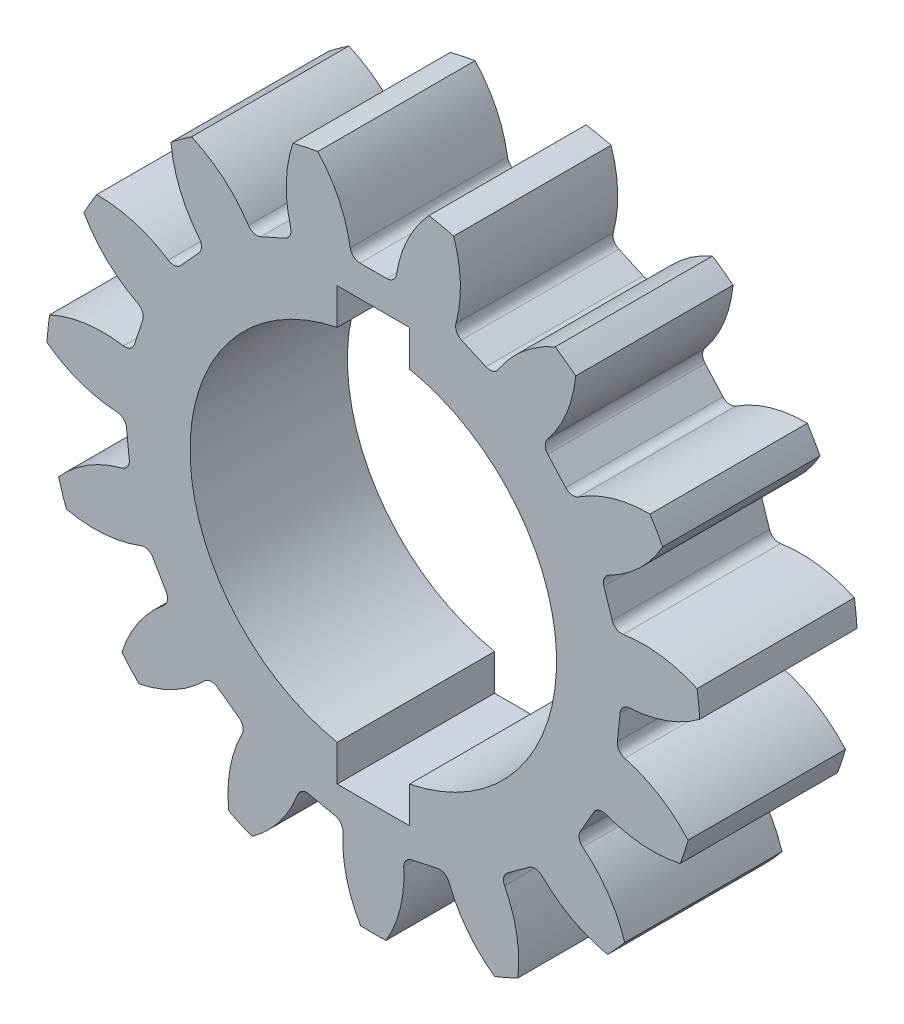
from build123d import *

# Parameters (mm, degrees)
SKETCH1_R                = 6.335999901
BOSS_EXTRUDE1_DEPTH      = 1.524
CUT_EXTRUDE1_DEPTH       = 10.089134474
FILLET1_R                = 0.191999997
CIRPATTERN1_COUNT        = 15
FILLET1_OF_CIRPATTERN1_R = 0.191999997
CUT_EXTRUDE2_DEPTH       = 10.455482489
CUT_EXTRUDE2_DEPTH_BACK  = 10.455482489
SKETCH4_R                = 3.55
SKETCH6_W                = 1.4
SKETCH6_H                = 0.7
CUT_EXTRUDE3_DEPTH       = 10.455482489


with BuildPart() as part:
    # Sketch1 → Boss-Extrude1 (new, symmetric)
    with BuildSketch(Plane.XY):
        with Locations(Location((0, 0, 0), (0, 0, 180))):
            Circle(SKETCH1_R)
    extrude(amount=BOSS_EXTRUDE1_DEPTH, both=True)

    # Sketch3 → Cut-Extrude1 (cut, symmetric)
    with BuildSketch(Plane.XY):
        with BuildLine():
            Line((-0.428414679, 4.780843037), (0.428414679, 4.780843037))
            ThreePointArc((0.428414679, 4.780843037), (1.010780942, 6.170659573), (2.288190337, 6.970012879))
            ThreePointArc((2.288190337, 6.970012879), (0, 7.335999901), (-2.288190337, 6.970012879))
            ThreePointArc((-2.288190337, 6.970012879), (-1.010780942, 6.170659573), (-0.428414679, 4.780843037))
        make_face()
    cut_extrude1 = extrude(amount=CUT_EXTRUDE1_DEPTH, both=True, mode=Mode.SUBTRACT)

    # Fillet1
    fillet1_edges = [part.edges().sort_by_distance(p)[0] for p in [
        (-0.428414679, 4.780843037, 0),
        (0.428414679, 4.780843037, 0),
    ]]
    fillet(fillet1_edges, radius=FILLET1_R)

    # CirPattern1: Cut-Extrude1 ×15 about axis
    cirpattern1_axis = Axis((0, 0, 0), (0, 0, 1))
    for i in range(1, CIRPATTERN1_COUNT):
        add(cut_extrude1.rotate(cirpattern1_axis, i * 360 / CIRPATTERN1_COUNT), mode=Mode.SUBTRACT)

    # Fillet1 of CirPattern1
    fillet1_of_cirpattern1_edges = [part.edges().sort_by_distance(p)[0] for p in [
        (-2.335920332, 4.193265492, 0),
        (-1.553167764, 4.541769388, 0),
        (-3.839524138, 2.880634248, 0),
        (-3.26619339, 3.517382552, 0),
        (-4.67923934, 1.069915174, 0),
        (-4.414464507, 1.884808318, 0),
        (-4.70987155, -0.925801954, 0),
        (-4.799434606, -0.073666397, 0),
        (-3.926124182, -2.761439514, 0),
        (-4.354538861, -2.019403523, 0),
        (-2.463514275, -4.119599094, 0),
        (-3.156703787, -3.615967434, 0),
        (-0.574940369, -4.765442566, 0),
        (-1.41304595, -4.587297726, 0),
        (1.41304595, -4.587297726, 0),
        (0.574940369, -4.765442566, 0),
        (3.156703787, -3.615967434, 0),
        (2.463514275, -4.119599094, 0),
        (4.354538861, -2.019403523, 0),
        (3.926124182, -2.761439514, 0),
        (4.799434606, -0.073666397, 0),
        (4.70987155, -0.925801954, 0),
        (4.414464507, 1.884808318, 0),
        (4.67923934, 1.069915174, 0),
        (3.26619339, 3.517382552, 0),
        (3.839524138, 2.880634248, 0),
        (1.553167764, 4.541769388, 0),
        (2.335920332, 4.193265492, 0),
    ]]
    fillet(fillet1_of_cirpattern1_edges, radius=FILLET1_OF_CIRPATTERN1_R)

    # Sketch4 → Cut-Extrude2 (cut, two sides: drawn at the far end of the back side and taken through both)
    with BuildSketch(Plane.XY.offset(1.524).offset(-CUT_EXTRUDE2_DEPTH_BACK)):
        Circle(SKETCH4_R)
    extrude(amount=CUT_EXTRUDE2_DEPTH + CUT_EXTRUDE2_DEPTH_BACK, mode=Mode.SUBTRACT)

    # Sketch6 → Cut-Extrude3 (cut, through all)
    with BuildSketch(Plane.XY.offset(1.524)):
        with Locations((0, 3.830301711)):
            Rectangle(SKETCH6_W, SKETCH6_H)
        with Locations((0, -3.830301711)):
            Rectangle(SKETCH6_W, SKETCH6_H)
    extrude(amount=-CUT_EXTRUDE3_DEPTH, mode=Mode.SUBTRACT)


solid = part.part
